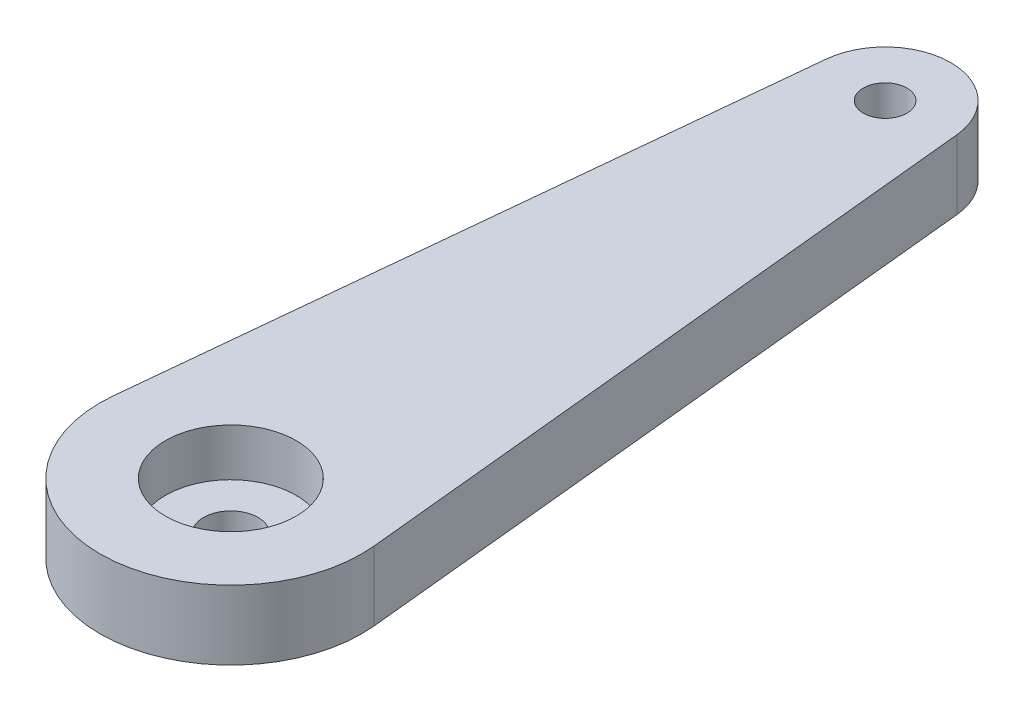
from build123d import *

# Parameters (mm, degrees)
SKETCH2_R           = 1
SKETCH2_R_2         = 3
BOSS_EXTRUDE1_DEPTH = 3.175
SKETCH2_4_R         = 3
SKETCH2_4_R_2       = 1.25
BOSS_EXTRUDE2_DEPTH = 1


with BuildPart() as part:
    # Sketch2 → Boss-Extrude1 (new body)
    with BuildSketch(Plane(origin=(0, 0, 0), x_dir=(1, 0, 0), z_dir=(0, 1, 0))):
        with BuildLine():
            Line((-3, 30.299992538), (-5.970224612, 0.597007611))
            ThreePointArc((-5.970224612, 0.597007611), (0, -6), (5.970224612, 0.597007611))
            Line((5.970224612, 0.597007611), (3, 30.299992538))
            ThreePointArc((3, 30.299992538), (0, 33.014961944), (-3, 30.299992538))
        make_face()
        with Locations(Location((0, 30, 0), (0, 0, 270))):
            Circle(SKETCH2_R, mode=Mode.SUBTRACT)
        with Locations(Location((0, 0, 0), (0, 0, 270))):
            Circle(SKETCH2_R_2, mode=Mode.SUBTRACT)
    extrude(amount=BOSS_EXTRUDE1_DEPTH)

    # Sketch2<4> → Boss-Extrude2 (add)
    with BuildSketch(Plane(origin=(0, 0, 0), x_dir=(1, 0, 0), z_dir=(0, 1, 0))):
        with Locations(Location((0, 0, 0), (0, 0, 270))):
            Circle(SKETCH2_4_R)
        with Locations(Location((0, 0, 0), (0, 0, 270))):
            Circle(SKETCH2_4_R_2, mode=Mode.SUBTRACT)
    extrude(amount=BOSS_EXTRUDE2_DEPTH)


solid = part.part
